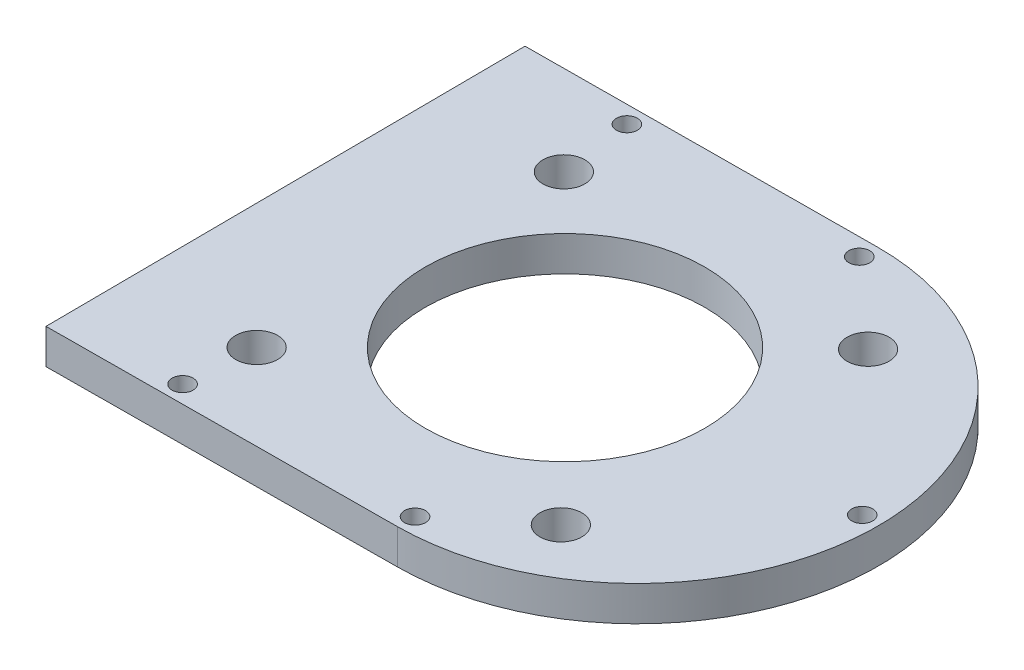
from build123d import *

# Parameters (mm, degrees)
SKETCH1_R           = 20
SKETCH1_R_2         = 3
SKETCH1_R_3         = 1.5
BOSS_EXTRUDE1_DEPTH = 5


with BuildPart() as part:
    # Sketch1 → Boss-Extrude1 (new body)
    with BuildSketch(Plane(origin=(0, 0, 0), x_dir=(1, 0, 0), z_dir=(0, 1, 0))):
        with BuildLine():
            Line((204.265004565, -121.165074652), (154.266061792, -121.490223172))
            Line((154.266061792, -121.490223172), (154.714766749, -190.488764199))
            Line((154.714766749, -190.488764199), (204.713709523, -190.163615679))
            ThreePointArc((204.713709523, -190.163615679), (238.988627557, -155.439992687), (204.265004565, -121.165074652))
        make_face()
        with Locations(Location((194.489996124, -155.990223157, 0), (0, 0, 270))):
            Circle(SKETCH1_R, mode=Mode.SUBTRACT)
        with Locations(Location((216.371480989, -134.502016601, 0), (0, 0, 270))):
            Circle(SKETCH1_R_2, mode=Mode.SUBTRACT)
        with Locations(Location((171.23195345, -123.879945011, 0), (0, 0, 270))):
            Circle(SKETCH1_R_3, mode=Mode.SUBTRACT)
        with Locations(Location((204.281261991, -123.665021791, 0), (0, 0, 270))):
            Circle(SKETCH1_R_3, mode=Mode.SUBTRACT)
        with Locations(Location((236.488680419, -155.456250113, 0), (0, 0, 270))):
            Circle(SKETCH1_R_3, mode=Mode.SUBTRACT)
        with Locations(Location((171.648143556, -187.87859176, 0), (0, 0, 270))):
            Circle(SKETCH1_R_3, mode=Mode.SUBTRACT)
        with Locations(Location((204.697452097, -187.663668541, 0), (0, 0, 270))):
            Circle(SKETCH1_R_3, mode=Mode.SUBTRACT)
        with Locations(Location((216.155888878, -178.252189218, 0), (0, 0, 270))):
            Circle(SKETCH1_R_2, mode=Mode.SUBTRACT)
        with Locations(Location((172.405716262, -178.036597107, 0), (0, 0, 270))):
            Circle(SKETCH1_R_2, mode=Mode.SUBTRACT)
        with Locations(Location((172.621308373, -134.286424491, 0), (0, 0, 270))):
            Circle(SKETCH1_R_2, mode=Mode.SUBTRACT)
    extrude(amount=BOSS_EXTRUDE1_DEPTH)


solid = part.part
